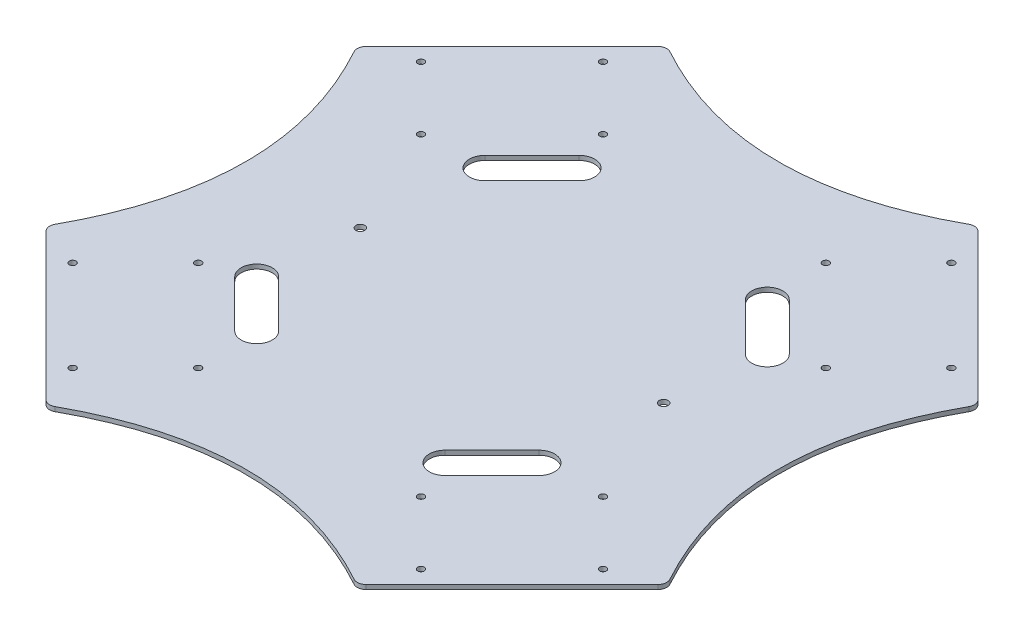
from build123d import *

# Parameters (mm, degrees)
DODANIE_WYCI_GNI_CIE1_DEPTH = 2
ZAOKR_GLENIE1_R             = 4
SZKIC2_R                    = 1.5
WYTNIJ_WYCI_GNI_CIE1_DEPTH  = 197.627390061
SZYK_KO_OWY1_COUNT          = 4
WYTNIJ_WYCI_GNI_CIE2_REACH  = 198.627
SZYK_KO_OWY2_COUNT          = 4
WYTNIJ_WYCI_GNI_CIE3_REACH  = 198.627
SZKIC4_R                    = 2


with BuildPart() as part:
    # Szkic1 → Dodanie-wyciągnięcie1 (new body)
    with BuildSketch(Plane(origin=(0, 0, 0), x_dir=(1, 0, 0), z_dir=(0, 1, 0))):
        with BuildLine():
            Line((-70, -140), (-140, -70))
            add(Edge.make_bspline(
                [(-140, 70), (-100, 0), (-140, -70)],
                knots=[0, 0, 0, 1, 1, 1], degree=2))
            Line((-140, 70), (-70, 140))
            add(Edge.make_bspline(
                [(70, 140), (0, 100), (-70, 140)],
                knots=[0, 0, 0, 1, 1, 1], degree=2))
            Line((70, 140), (140, 70))
            add(Edge.make_bspline(
                [(140, -70), (100, 0), (140, 70)],
                knots=[0, 0, 0, 1, 1, 1], degree=2))
            Line((140, -70), (70, -140))
            add(Edge.make_bspline(
                [(-70, -140), (0, -100), (70, -140)],
                knots=[0, 0, 0, 1, 1, 1], degree=2))
        make_face()
    extrude(amount=DODANIE_WYCI_GNI_CIE1_DEPTH)

    # Zaokrąglenie1
    zaokr_glenie1_edges = [part.edges().sort_by_distance(p)[0] for p in [
        (-140, 1, -70),
        (-70, 1, -140),
        (70, 1, -140),
        (140, 1, -70),
        (140, 1, 70),
        (70, 1, 140),
        (-140, 1, 70),
        (-70, 1, 140),
    ]]
    fillet(zaokr_glenie1_edges, radius=ZAOKR_GLENIE1_R)

    # Szkic2 → Wytnij-wyciągnięcie1 (cut, through all)
    with BuildSketch(Plane(origin=(0, 2, 0), x_dir=(1, 0, 0), z_dir=(0, 1, 0))):
        with Locations((-78.488852712, -119.501046021)):
            Circle(SZKIC2_R)
        with Locations((-119.501046021, -78.488852712)):
            Circle(SZKIC2_R)
        with Locations((-50.204581464, -91.216774773)):
            Circle(SZKIC2_R)
        with Locations((-91.216774773, -50.204581464)):
            Circle(SZKIC2_R)
    wytnij_wyci_gni_cie1 = extrude(amount=-WYTNIJ_WYCI_GNI_CIE1_DEPTH, mode=Mode.SUBTRACT)

    # Szyk kołowy1: Wytnij-wyciągnięcie1 ×4 about axis
    szyk_ko_owy1_axis = Axis((0, -82.27937755, 0), (0, 1, 0))
    for i in range(1, SZYK_KO_OWY1_COUNT):
        add(wytnij_wyci_gni_cie1.rotate(szyk_ko_owy1_axis, i * 360 / SZYK_KO_OWY1_COUNT), mode=Mode.SUBTRACT)

    # Szkic3 → Wytnij-wyciągnięcie2 (cut, up to next)
    with BuildSketch(Plane(origin=(0, 2, 0), x_dir=(1, 0, 0), z_dir=(0, 1, 0)), mode=Mode.PRIVATE) as wytnij_wyci_gni_cie2_sk1:
        with BuildLine():
            Line((-47.355448856, 77.60029226), (-68.568652292, 56.387088824))
            ThreePointArc((-68.568652292, 56.387088824), (-68.568652292, 46.487593888), (-58.669157355, 46.487593888))
            Line((-58.669157355, 46.487593888), (-37.45595392, 67.700797323))
            ThreePointArc((-37.45595392, 67.700797323), (-37.45595392, 77.60029226), (-47.355448856, 77.60029226))
        make_face()
    wytnij_wyci_gni_cie2_tool1 = extrude(wytnij_wyci_gni_cie2_sk1.sketch, amount=-WYTNIJ_WYCI_GNI_CIE2_REACH, mode=Mode.PRIVATE) & part.part
    wytnij_wyci_gni_cie2 = wytnij_wyci_gni_cie2_tool1.solids().sort_by_distance((-53.012303, 2, -62.043943))[0]
    add(wytnij_wyci_gni_cie2, mode=Mode.SUBTRACT)

    # Szyk kołowy2: Wytnij-wyciągnięcie2 ×4 about axis
    szyk_ko_owy2_axis = Axis((0, -82.27937755, 0), (0, 1, 0))
    for i in range(1, SZYK_KO_OWY2_COUNT):
        add(wytnij_wyci_gni_cie2.rotate(szyk_ko_owy2_axis, i * 360 / SZYK_KO_OWY2_COUNT), mode=Mode.SUBTRACT)

    # Szkic4 → Wytnij-wyciągnięcie3 (cut, up to next)
    with BuildSketch(Plane(origin=(0, 2, 0), x_dir=(1, 0, 0), z_dir=(0, 1, 0)), mode=Mode.PRIVATE) as wytnij_wyci_gni_cie3_sk1:
        with Locations((-68.34, 0)):
            Circle(SZKIC4_R)
    wytnij_wyci_gni_cie3_tool1 = extrude(wytnij_wyci_gni_cie3_sk1.sketch, amount=-WYTNIJ_WYCI_GNI_CIE3_REACH, mode=Mode.PRIVATE) & part.part
    # Szkic4 → Wytnij-wyciągnięcie3 (cut, up to next)
    with BuildSketch(Plane(origin=(0, 2, 0), x_dir=(1, 0, 0), z_dir=(0, 1, 0)), mode=Mode.PRIVATE) as wytnij_wyci_gni_cie3_sk2:
        with Locations((68.34, 0)):
            Circle(SZKIC4_R)
    wytnij_wyci_gni_cie3_tool2 = extrude(wytnij_wyci_gni_cie3_sk2.sketch, amount=-WYTNIJ_WYCI_GNI_CIE3_REACH, mode=Mode.PRIVATE) & part.part
    add(wytnij_wyci_gni_cie3_tool1.solids().sort_by_distance((-68.34, 2, 0))[0], mode=Mode.SUBTRACT)
    add(wytnij_wyci_gni_cie3_tool2.solids().sort_by_distance((68.34, 2, 0))[0], mode=Mode.SUBTRACT)


solid = part.part
